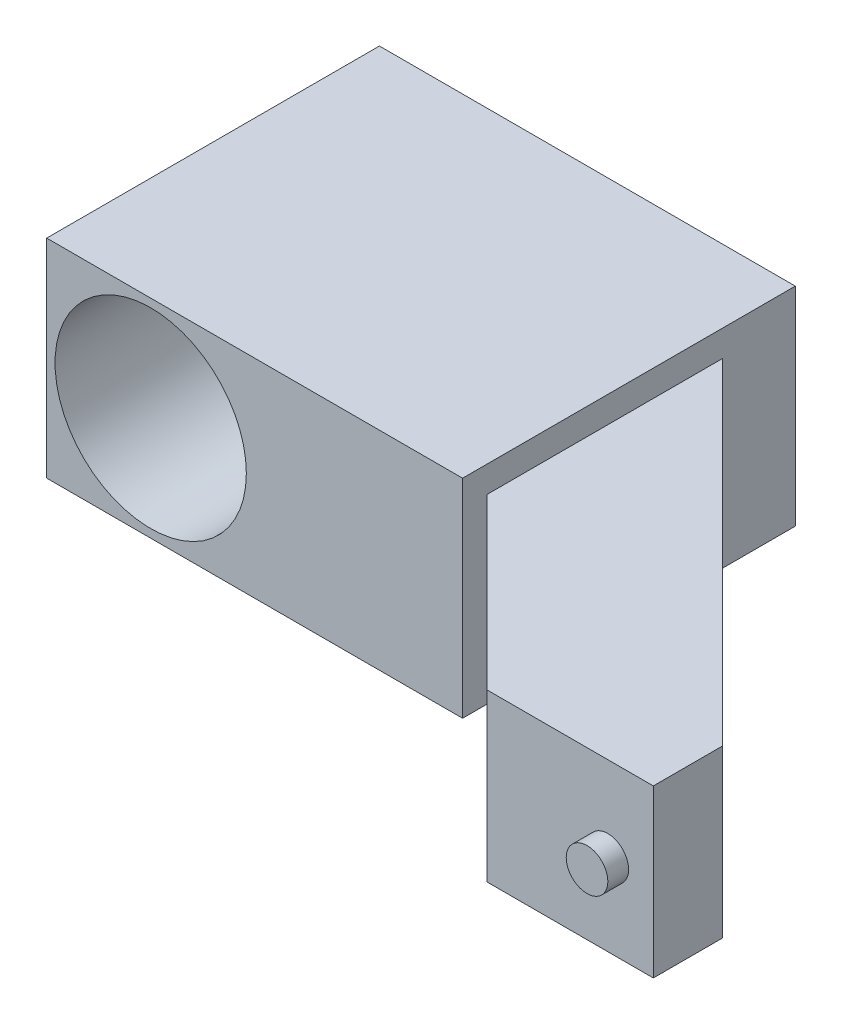
from build123d import *

# Parameters (mm, degrees)
IZIM1_W                     = 100
IZIM1_H                     = 50
Y_KSEKLIK_EKSTR_ZYON1_DEPTH = 80
IZIM2_W                     = 40
IZIM2_H                     = 40
Y_KSEKLIK_EKSTR_ZYON6_DEPTH = 150
KES_EKSTR_ZYON4_DEPTH       = 50
IZIM12_R                    = 5
Y_KSEKLIK_EKSTR_ZYON9_DEPTH = 5
IZIM13_R                    = 23
KES_EKSTR_ZYON9_DEPTH       = 78
IZIM14_R                    = 2
KES_EKSTR_ZYON10_DEPTH      = 78
IZIM15_W                    = 16.621675202
IZIM15_H                    = 40
KES_EKSTR_ZYON15_DEPTH      = 20


with BuildPart() as part:
    # Çizim1 → Yükseklik-Ekstrüzyon1 (new body)
    with BuildSketch(Plane.XY):
        with Locations((-50, -0.013722327)):
            Rectangle(IZIM1_W, IZIM1_H)
    extrude(amount=Y_KSEKLIK_EKSTR_ZYON1_DEPTH)

    # Çizim2 → Yükseklik-Ekstrüzyon6 (add)
    with BuildSketch(Plane(origin=(0, 0, 0), x_dir=(0, 1, 0), z_dir=(0.7071067811865561, 0, 0.7071067811865389))):
        with Locations((-1.342558947, 32.385430267)):
            Rectangle(IZIM2_W, IZIM2_H)
    extrude(amount=Y_KSEKLIK_EKSTR_ZYON6_DEPTH)

    # Çizim11 → Kes-Ekstrüzyon4 (cut)
    with BuildSketch(Plane(origin=(0, 0, 114.823838907), x_dir=(0, 1, 0), z_dir=(0, 0, 1))):
        Polygon((18.657441053, -97.308195449), (-21.342558947, -97.308195449), (-41.210000873, -31.823007329), (29.36267087, -31.823007329), align=None)
    extrude(amount=KES_EKSTR_ZYON4_DEPTH, mode=Mode.SUBTRACT)

    # Çizim12 → Yükseklik-Ekstrüzyon9 (add)
    with BuildSketch(Plane.XY.offset(114.823838907)):
        with Locations(Location((69.745895445, -1.722983567, 0), (0, 0, 180))):
            Circle(IZIM12_R)
    extrude(amount=Y_KSEKLIK_EKSTR_ZYON9_DEPTH)

    # Çizim13 → Kes-Ekstrüzyon9 (cut)
    with BuildSketch(Plane.XY.offset(80)):
        with Locations((-75, -0.013722327)):
            Circle(IZIM13_R)
    extrude(amount=-KES_EKSTR_ZYON9_DEPTH, mode=Mode.SUBTRACT)

    # Çizim14 → Kes-Ekstrüzyon10 (cut)
    with BuildSketch(Plane(origin=(0, 0, 0), x_dir=(-1, 0, 0), z_dir=(0, 0, -1))):
        with Locations((75, -0.013722327)):
            Circle(IZIM14_R)
    extrude(amount=-KES_EKSTR_ZYON10_DEPTH, mode=Mode.SUBTRACT)

    # Çizim15 → Kes-Ekstrüzyon15 (cut)
    with BuildSketch(Plane.XY.offset(114.823838907)):
        with Locations((88.997357848, -1.342558947)):
            Rectangle(IZIM15_W, IZIM15_H)
    extrude(amount=-KES_EKSTR_ZYON15_DEPTH, mode=Mode.SUBTRACT)


solid = part.part
